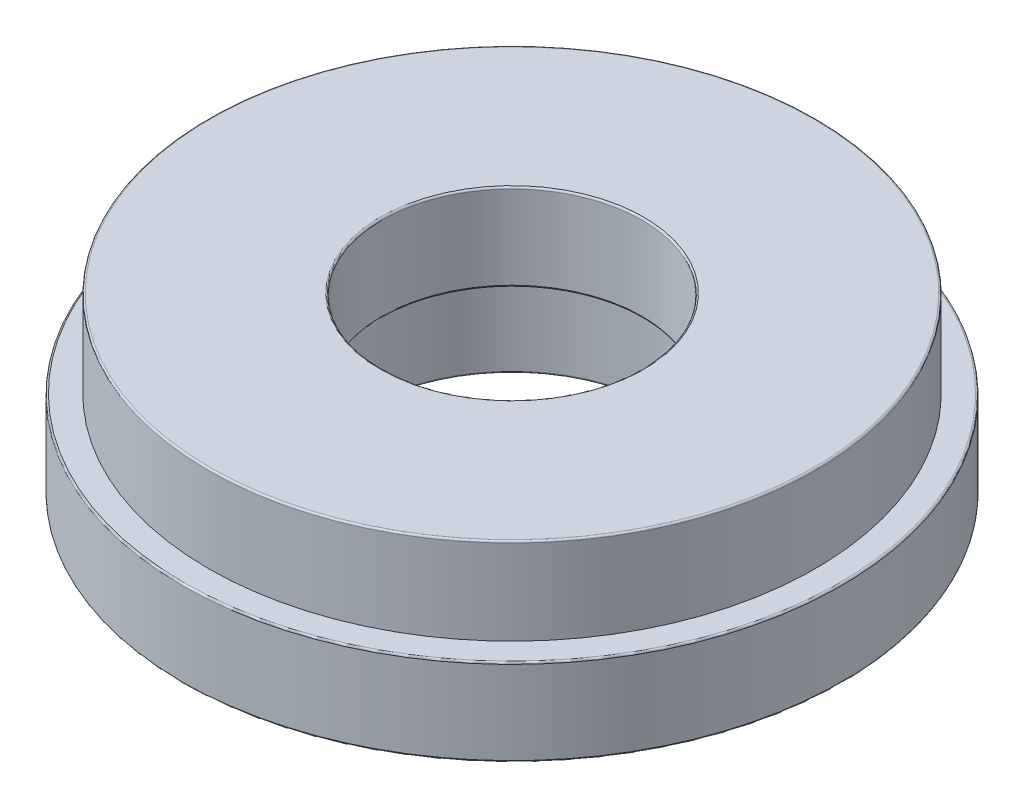
from build123d import *

# Parameters (mm, degrees)
SKETCH_1_R          = 19
EXTRUDE_1_DEPTH     = 5
SKETCH_1_3_R        = 3.1
CUT_EXTRUDE_1_DEPTH = 4
SKETCH_5_R          = 17.5
SKETCH_5_R_2        = 7.5
EXTRUDE_3_DEPTH     = 5
SKETCH_8_R          = 8.5
CUT_EXTRUDE_4_DEPTH = 5
FILLET_1_R          = 0.1


with BuildPart() as part:
    # 草图1 → 凸台-拉伸1 (new body)
    with BuildSketch(Plane(origin=(0, 0, 0), x_dir=(1, 0, 0), z_dir=(0, 1, 0))):
        with Locations(Location((0, 0, 0), (0, 0, 270))):
            Circle(SKETCH_1_R)
    extrude(amount=EXTRUDE_1_DEPTH)

    # 草图1<3> → 切除-拉伸1 (cut)
    with BuildSketch(Plane(origin=(0, 0, 0), x_dir=(1, 0, 0), z_dir=(0, 1, 0))):
        with Locations(Location((-12.990381057, 7.5, 0), (0, 0, 270))):
            Circle(SKETCH_1_3_R)
        with Locations(Location((-12.990381057, -7.5, 0), (0, 0, 270))):
            Circle(SKETCH_1_3_R)
        with Locations(Location((0, -15, 0), (0, 0, 270))):
            Circle(SKETCH_1_3_R)
        with Locations(Location((12.990381057, -7.5, 0), (0, 0, 270))):
            Circle(SKETCH_1_3_R)
        with Locations(Location((12.990381057, 7.5, 0), (0, 0, 270))):
            Circle(SKETCH_1_3_R)
        with Locations(Location((0, 15, 0), (0, 0, 270))):
            Circle(SKETCH_1_3_R)
    extrude(amount=CUT_EXTRUDE_1_DEPTH, mode=Mode.SUBTRACT)

    # 草图5 → 凸台-拉伸3 (add)
    with BuildSketch(Plane(origin=(0, 5, 0), x_dir=(1, 0, 0), z_dir=(0, 1, 0))):
        with Locations(Location((0, 0, 0), (0, 0, 270))):
            Circle(SKETCH_5_R)
        with Locations(Location((0, 0, 0), (0, 0, 270))):
            Circle(SKETCH_5_R_2, mode=Mode.SUBTRACT)
    extrude(amount=EXTRUDE_3_DEPTH)

    # 草图8 → 切除-拉伸4 (cut)
    with BuildSketch(Plane.XZ):
        with Locations(Location((0, 0, 0), (0, 0, 270))):
            Circle(SKETCH_8_R)
    extrude(amount=-CUT_EXTRUDE_4_DEPTH, mode=Mode.SUBTRACT)

    # 圆角1
    fillet_1_edges = [part.edges().sort_by_distance(p)[0] for p in [
        (0, 0, -18.1),
        (12.990381057, 0, -10.6),
        (12.990381057, 0, 4.4),
        (0, 0, 11.9),
        (-12.990381057, 0, 4.4),
        (-12.990381057, 0, -10.6),
        (0, 0, -19),
        (0, 10, -17.5),
        (0, 10, -7.5),
        (0, 5, -7.5),
        (0, 0, 8.5),
        (0, 5, -19),
    ]]
    fillet(fillet_1_edges, radius=FILLET_1_R)


solid = part.part
